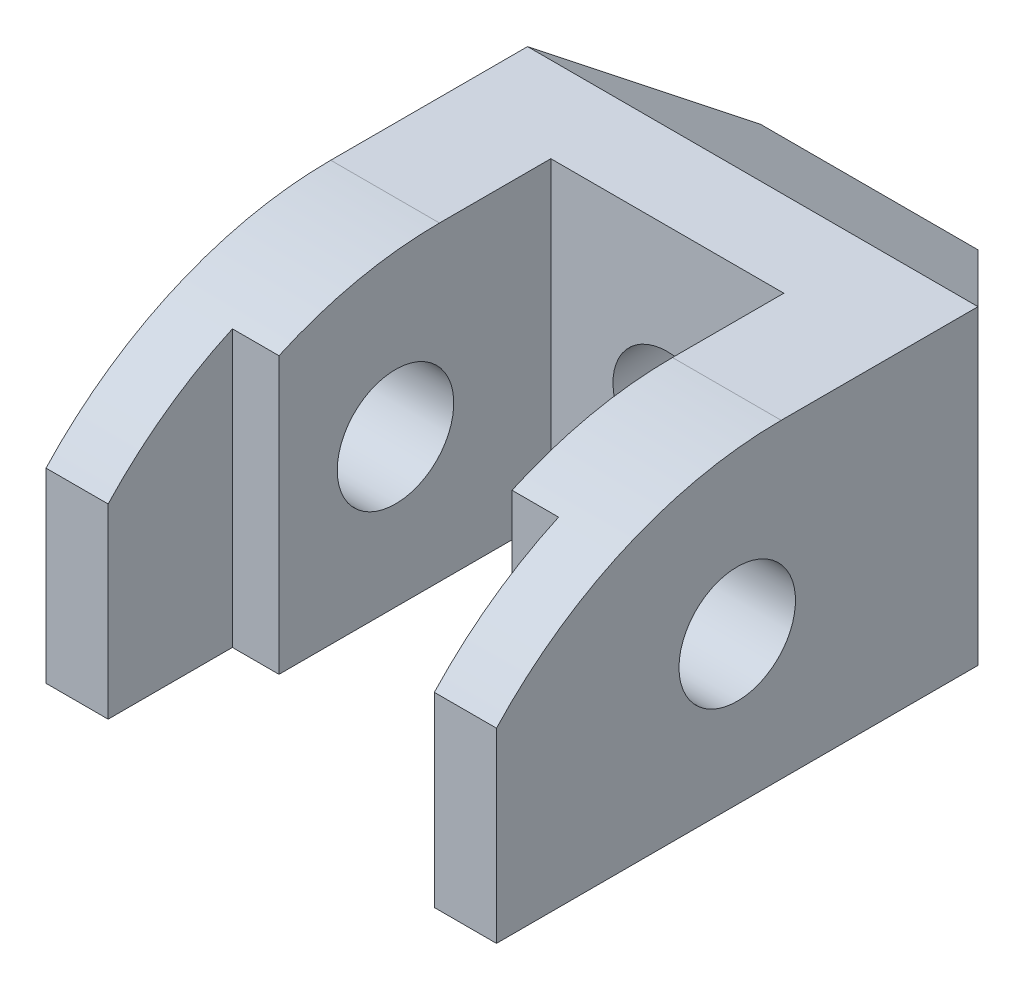
from build123d import *

# Parameters (mm, degrees)
SKETCH1_R           = 7.5
BOSS_EXTRUDE1_DEPTH = 29
CUT_EXTRUDE1_DEPTH  = 68.505555327
SKETCH3_R           = 7
CUT_EXTRUDE2_DEPTH  = 85.917607126
CUT_EXTRUDE3_DEPTH  = 68.505555438


with BuildPart() as part:
    # Sketch1 → Boss-Extrude1 (new, symmetric)
    with BuildSketch(Plane(origin=(0, 0, 0), x_dir=(0, 0, -1), z_dir=(1, 0, 0))):
        with BuildLine():
            Line((-31, 5), (-31, -19))
            Line((-31, -19), (31, -19))
            Line((31, -19), (46, -10.339745962))
            Line((46, -10.339745962), (46, 12.339745962))
            Line((46, 12.339745962), (31, 21))
            Line((31, 21), (5.66060556, 21))
            ThreePointArc((5.66060556, 21), (-14.33939444, 16.82575695), (-31, 5))
        make_face()
        with Locations(Location((0, 0, 0), (0, 0, 180))):
            Circle(SKETCH1_R, mode=Mode.SUBTRACT)
    extrude(amount=BOSS_EXTRUDE1_DEPTH, both=True)

    # Sketch2 → Cut-Extrude1 (cut, through all)
    with BuildSketch(Plane(origin=(0, 21, 0), x_dir=(1, 0, 0), z_dir=(0, 1, 0))):
        Polygon((-29, 31), (-14, 46), (-29, 46), align=None)
        Polygon((29, 31), (29, 46), (14, 46), align=None)
    extrude(amount=-CUT_EXTRUDE1_DEPTH, mode=Mode.SUBTRACT)

    # Sketch3 → Cut-Extrude2 (cut, through all)
    with BuildSketch(Plane(origin=(0, 0, -46), x_dir=(-1, 0, 0), z_dir=(0, 0, -1))):
        with Locations(Location((0, 0, 0), (0, 0, 90))):
            Circle(SKETCH3_R)
    extrude(amount=-CUT_EXTRUDE2_DEPTH, mode=Mode.SUBTRACT)

    # Sketch4 → Cut-Extrude3 (cut, through all)
    with BuildSketch(Plane(origin=(0, 21, 0), x_dir=(1, 0, 0), z_dir=(0, 1, 0))):
        Polygon((-21, -31), (21, -31), (21, -15), (15, -15), (15, 20), (-15, 20), (-15, -15), (-21, -15), align=None)
    extrude(amount=-CUT_EXTRUDE3_DEPTH, mode=Mode.SUBTRACT)


solid = part.part
